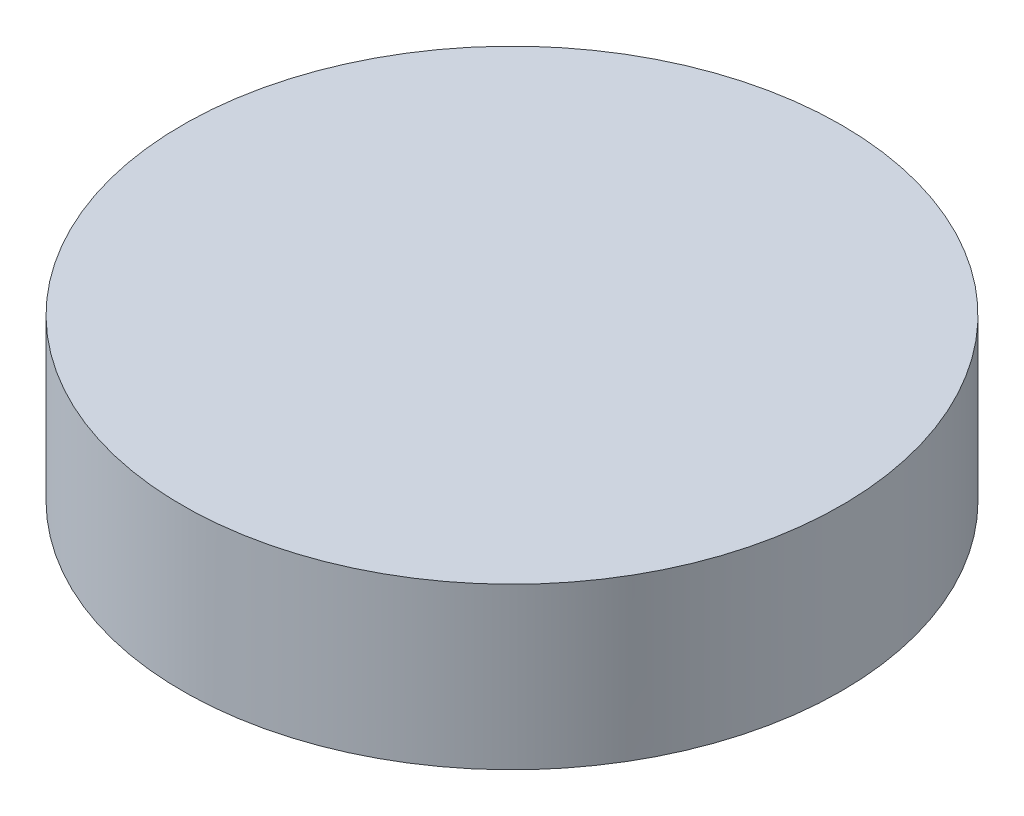
from build123d import *


with BuildPart() as part:
    # 草图4 → 旋转1 (revolve)
    with BuildSketch(Plane.XY, mode=Mode.PRIVATE) as revolve_1_sk:
        with BuildLine():
            Line((0, 20), (0, 21.831999596))
            Line((0, 21.831999596), (44.768578, 21.831999596))
            Line((44.768578, 21.831999596), (44.768578, 1.2849e-05))
            add(Edge.make_bspline(
                [(0, 20), (0.066670165, 20.000092753), (0.160959333, 20.00022393), (0.310056972, 19.999551278), (0.431999365, 19.998698222), (0.568738933, 19.997290174), (0.778979171, 19.994586825), (1.028103777, 19.989993475), (1.244875505, 19.984586774), (1.352893657, 19.981590218), (1.405855054, 19.980063878), (1.457758948, 19.978511319), (1.503384329, 19.977088099), (1.559475575, 19.975310934), (1.610612554, 19.97360254), (1.664530016, 19.971746278), (1.696388446, 19.970623034), (1.758062662, 19.968409647), (1.814595448, 19.966287241), (1.873631922, 19.963997867), (1.916153911, 19.962305005), (1.96471993, 19.960337259), (2.038092076, 19.957268737), (2.106642331, 19.954291275), (2.167532326, 19.95154177), (2.198544811, 19.950124024), (2.229054767, 19.948702465), (2.276753009, 19.946466866), (2.323911011, 19.944181), (2.370380004, 19.941890467), (2.420871406, 19.939353797), (2.470860029, 19.93680178), (2.517531462, 19.934338404), (2.565225672, 19.93181844), (2.612495696, 19.929239022), (2.65935507, 19.926640485), (2.704683181, 19.924089272), (2.747207281, 19.921664142), (2.789396864, 19.919204403), (2.808872778, 19.918056223), (2.847263962, 19.915794686), (2.885377937, 19.913492609), (2.925542269, 19.911041725), (2.951114279, 19.909459492), (2.976515675, 19.907884684), (3.003953409, 19.906156818), (3.028915953, 19.904585043), (3.058167833, 19.902708981), (3.082714264, 19.901132088), (3.124519588, 19.898406572), (3.163772792, 19.895828952), (3.204923084, 19.893062229), (3.243143946, 19.890489343), (3.274844783, 19.888312014), (3.306316387, 19.886137465), (3.322907305, 19.884979169), (3.36389289, 19.882123239), (3.402594465, 19.879362752), (3.441101141, 19.876594304), (3.478802585, 19.873853333), (3.518270049, 19.870971472), (3.55948142, 19.867892053), (3.594194486, 19.86529849), (3.643751787, 19.861533674), (3.702292322, 19.85702447), (3.749032745, 19.853357601), (3.780466843, 19.850876435), (3.813330159, 19.848251031), (3.842426912, 19.84591963), (3.869579981, 19.843719785), (3.883941066, 19.842546919), (3.912450873, 19.840228557), (3.940852133, 19.837878673), (3.970899329, 19.835384957), (3.990176552, 19.83376901), (4.009385573, 19.832162026), (4.028502928, 19.830543597), (4.047532198, 19.828939348), (4.066493968, 19.827317851), (4.083663534, 19.825853732), (4.114290964, 19.823212752), (4.146495266, 19.820436893), (4.178589231, 19.817618304), (4.201996137, 19.81556949), (4.231897784, 19.812917062), (4.261704412, 19.810258289), (4.286401281, 19.808048092), (4.312515551, 19.805684522), (4.346603741, 19.802602103), (4.378951881, 19.799628881), (4.406246494, 19.797116795), (4.431749486, 19.794749735), (4.458756145, 19.792234753), (4.493427247, 19.788971225), (4.523218859, 19.786164886), (4.554446379, 19.783178156), (4.583835765, 19.780371686), (4.614646381, 19.777391849), (4.643800801, 19.774560495), (4.671194514, 19.771878215), (4.696968282, 19.769355682), (4.72265247, 19.766806698), (4.749635994, 19.764136352), (4.772073426, 19.761887258), (4.794438207, 19.759644051), (4.806303073, 19.758444734), (4.821111419, 19.756954808), (4.838809587, 19.755154538), (4.857930857, 19.753215143), (4.877006016, 19.751264797), (4.893084467, 19.749620871), (4.919242735, 19.746920544), (4.945342847, 19.744234455), (4.969924292, 19.741664979), (4.99145536, 19.739426944), (5.017204535, 19.73671461), (5.042897845, 19.734007386), (5.059951215, 19.732194198), (5.082561665, 19.729797815), (5.105121862, 19.727380838), (5.127634709, 19.724966468), (5.140240146, 19.723603879), (5.156996671, 19.721800523), (5.179260952, 19.719382764), (5.20286094, 19.716817967), (5.23185606, 19.713637267), (5.256619456, 19.710924392), (5.28267804, 19.708033092), (5.308570157, 19.705167604), (5.333041483, 19.702428554), (5.354738693, 19.699999465), (5.366892396, 19.698627777), (5.387074649, 19.696360446), (5.407217007, 19.694073855), (5.427322525, 19.691792399), (5.439340587, 19.690417716), (5.455322302, 19.688598142), (5.481844935, 19.685552448), (5.518823127, 19.681294967), (5.551747942, 19.677465103), (5.575350126, 19.674714161), (5.597505492, 19.672110766), (5.620919041, 19.669369338), (5.652010119, 19.665683169), (5.675238681, 19.662934533), (5.697131393, 19.660316558), (5.709964316, 19.658785418), (5.721490729, 19.657398569), (5.74064118, 19.655105758), (5.76229605, 19.65248894), (5.785181978, 19.649720095), (5.802915059, 19.647560387), (5.819343347, 19.645562729), (5.834479185, 19.643711419), (5.847066619, 19.642173354), (5.858373683, 19.640780501), (5.875914785, 19.638630545), (5.894673077, 19.636310062), (5.914647151, 19.633841586), (5.93701483, 19.631054228), (5.959339776, 19.6282826), (5.981616921, 19.625483839), (6.002561013, 19.622862838), (6.019785431, 19.620684095), (6.036977449, 19.618513565), (6.047994155, 19.617113591), (6.067539519, 19.614641123), (6.083398796, 19.612613876), (6.099229082, 19.610594535), (6.10894487, 19.609346869), (6.121079558, 19.607797164), (6.134398051, 19.606079795), (6.147699826, 19.604376332), (6.160980996, 19.60265619), (6.171828694, 19.601258482), (6.187460074, 19.599226323), (6.204269023, 19.597052347), (6.221052889, 19.594860919), (6.233015405, 19.59330328), (6.252094116, 19.59079884), (6.272336134, 19.588155075), (6.292547611, 19.585482983), (6.313853539, 19.582680755), (6.331585822, 19.580320516), (6.350473019, 19.577812479), (6.36106229, 19.576397423), (6.379853929, 19.573898035), (6.395103493, 19.571849195), (6.410328491, 19.569808496), (6.420841652, 19.568390405), (6.440661079, 19.565729638), (6.456963265, 19.563518135), (6.472080276, 19.561472459), (6.482515158, 19.560050722), (6.502188271, 19.557385455), (6.521834221, 19.554696025), (6.5402923, 19.552173802), (6.55868279, 19.549641459), (6.578197893, 19.546967095), (6.601103548, 19.54379414), (6.623931823, 19.540642), (6.647856508, 19.537308513), (6.675111357, 19.533508228), (6.695504151, 19.530646558), (6.713604246, 19.528106834), (6.73163558, 19.5255599), (6.750771187, 19.522869207), (6.771002373, 19.519993403), (6.788928965, 19.517456142), (6.803478534, 19.515377276), (6.818008126, 19.51330638), (6.828044502, 19.511867147), (6.84586059, 19.509324906), (6.860320633, 19.507241597), (6.875869401, 19.505007118), (6.886951032, 19.503403913), (6.902450999, 19.501173098), (6.916819113, 19.499087755), (6.931168513, 19.497011122), (6.949886503, 19.494286905), (6.970770906, 19.491243439), (6.991624978, 19.488188155), (7.011326697, 19.485308508), (7.025536469, 19.483212362), (7.038638919, 19.481284708), (7.047355509, 19.479993908), (7.065847625, 19.477271327), (7.084318039, 19.474525962), (7.103847565, 19.471628696), (7.117916025, 19.469525259), (7.131973103, 19.467437041), (7.143849882, 19.46565499), (7.154632959, 19.464045399), (7.171850211, 19.461452842), (7.1890539, 19.458878728), (7.20623193, 19.456279103), (7.224432523, 19.453538849), (7.242612788, 19.45077723), (7.26077167, 19.448023083), (7.27462219, 19.445908073), (7.289523933, 19.44364215), (7.304405746, 19.441364964), (7.322436824, 19.438608235), (7.338330578, 19.436165445), (7.354205502, 19.433724396), (7.364767419, 19.432092176), (7.379538587, 19.429819728), (7.394289834, 19.42753167), (7.407974705, 19.425415568), (7.418486117, 19.423778178), (7.433178774, 19.42150091), (7.449948504, 19.418882926), (7.474011408, 19.415128788), (7.491769645, 19.412342472), (7.50742114, 19.409885829), (7.52510341, 19.407095481), (7.544852189, 19.403994244), (7.565615121, 19.400699236), (7.583215403, 19.39791802), (7.609037287, 19.393801966), (7.63380335, 19.389854866), (7.652346204, 19.386886231), (7.661599482, 19.385405673), (7.67801924, 19.382761753), (7.694428618, 19.38013445), (7.712864972, 19.377150223), (7.729217151, 19.374517105), (7.745553269, 19.37186438), (7.761869657, 19.369220786), (7.775102421, 19.367060846), (7.788327518, 19.364916504), (7.800518494, 19.362920738), (7.817758893, 19.36011039), (7.833972237, 19.357449737), (7.849159289, 19.354958496), (7.864307118, 19.352460671), (7.881464561, 19.349645928), (7.899610998, 19.346638771), (7.917716044, 19.343651861), (7.934797279, 19.34081142), (7.958870285, 19.336814788), (7.973893454, 19.334302993), (7.988906965, 19.33179792), (8.004875876, 19.329117195), (8.023831048, 19.325953517), (8.042767642, 19.322759602), (8.058677716, 19.320086887), (8.073578679, 19.317566125), (8.090452054, 19.314716926), (8.102342892, 19.312694998), (8.114227918, 19.310687154), (8.124120759, 19.309000776), (8.134993705, 19.307157121), (8.147828932, 19.304961273), (8.159672814, 19.302950098), (8.169531482, 19.30126078), (8.178396857, 19.299749036), (8.190205658, 19.297719554), (8.202990702, 19.295533512), (8.222624808, 19.292156119), (8.240281473, 19.289125379), (8.258896537, 19.285902335), (8.276494678, 19.282867369), (8.292127331, 19.280150425), (8.308719032, 19.277273256), (8.321383206, 19.275062444), (8.350555334, 19.269994127), (8.376778178, 19.265392353), (8.401034577, 19.261139805), (8.412648333, 19.259091011), (8.431980047, 19.255694639), (8.450328725, 19.252450164), (8.466733136, 19.24955017), (8.477329478, 19.247668269), (8.493688191, 19.244772541), (8.508113611, 19.242201292), (8.521566384, 19.239808114), (8.529243491, 19.238435082), (8.544585143, 19.235703631), (8.559912011, 19.232957116), (8.582872375, 19.228845959), (8.61150408, 19.223695991), (8.649612448, 19.216821456), (8.680054255, 19.211299735), (8.70568033, 19.206648858), (8.718947003, 19.204225236), (8.732207615, 19.201808542), (8.747329904, 19.19903652), (8.764340052, 19.195938398), (8.786988334, 19.191769609), (8.802068499, 19.189007832), (8.818076586, 19.186049574), (8.834062094, 19.183108734), (8.849094669, 19.180323762), (8.86974108, 19.17650629), (8.882865684, 19.174064123), (8.89598472, 19.171628875), (8.910013173, 19.169009759), (8.925910338, 19.166061065), (8.950184661, 19.161511268), (8.96697375, 19.158382304), (8.989329353, 19.154173417), (9.004216281, 19.151385058), (9.020019804, 19.148398548), (9.034875613, 19.145603779), (9.048791733, 19.14296751), (9.066403545, 19.139639709), (9.079367997, 19.137182513), (9.092324088, 19.134714884), (9.101571161, 19.132961493), (9.11265781, 19.130843899), (9.123741871, 19.128740777), (9.134815644, 19.126621149), (9.150487788, 19.123634294), (9.166149106, 19.120630252), (9.186397867, 19.11675327), (9.198350493, 19.114451312), (9.211216863, 19.111979044), (9.222229841, 19.109852099), (9.235076921, 19.107383805), (9.246996796, 19.105075945), (9.256159864, 19.103309113), (9.273545882, 19.099932784), (9.29549288, 19.095688891), (9.314684295, 19.091950481), (9.325639488, 19.08981948), (9.339311927, 19.087145197), (9.354806704, 19.084134083), (9.376653238, 19.079845615), (9.392114504, 19.07682651), (9.407564227, 19.073783437), (9.418460046, 19.071645784), (9.429347757, 19.069498951), (9.441138115, 19.067179467), (9.453822713, 19.064667856), (9.469216458, 19.061633693), (9.487308994, 19.05804598), (9.5044845, 19.054642195), (9.524345462, 19.050687122), (9.542389019, 19.047107454), (9.564913487, 19.042599763), (9.581120212, 19.039371881), (9.60180148, 19.035216739), (9.616179288, 19.032343229), (9.63592652, 19.028361117), (9.650278158, 19.025481891), (9.669990166, 19.021494354), (9.685212343, 19.01842862), (9.706675323, 19.014070817), (9.722763669, 19.010820351), (9.743296989, 19.006634165), (9.757570801, 19.003738852), (9.778066297, 18.999547045), (9.794986091, 18.996101898), (9.816334435, 18.991718412), (9.833223002, 18.988265448), (9.852756687, 18.984239685), (9.866955767, 18.981327286), (9.884684103, 18.977661114), (9.898859854, 18.974744341), (9.913910477, 18.971622636), (9.925412656, 18.969247616), (9.936022975, 18.967042732), (9.945746524, 18.96502851), (9.9563448, 18.962819949), (9.967823933, 18.960438872), (9.985467501, 18.956760786), (10.002218724, 18.953269094), (10.020719719, 18.949396394), (10.04359624, 18.944617624), (10.066454243, 18.939812327), (10.091929617, 18.934460596), (10.10509154, 18.931677068), (10.124380939, 18.927612268), (10.138397074, 18.924638779), (10.160287963, 18.920013264), (10.172534608, 18.917405393), (10.184778988, 18.914807513), (10.197007983, 18.912198216), (10.211857686, 18.90904857), (10.237157517, 18.903638957), (10.254598144, 18.899920126), (10.272897482, 18.895994469), (10.280734423, 18.894319746), (10.293786129, 18.891508275), (10.304227144, 18.889274318), (10.314661451, 18.887023997), (10.324222128, 18.88497124), (10.335515759, 18.882538275), (10.347671536, 18.879906517), (10.36069017, 18.877101082), (10.372833697, 18.87446914), (10.384107141, 18.872030857), (10.400564593, 18.868455117), (10.421345452, 18.863953279), (10.448163266, 18.858107749), (10.467179468, 18.853958285), (10.487907379, 18.84943516), (10.500852498, 18.846594421), (10.512931915, 18.843948466), (10.518966784, 18.842620496), (10.529311573, 18.840355797), (10.540511796, 18.83788907), (10.55515358, 18.834672816), (10.565483702, 18.832393828), (10.57495063, 18.830308343), (10.586128175, 18.827833082), (10.599027573, 18.824995774), (10.611918524, 18.822136181), (10.621368411, 18.820050534), (10.639390761, 18.816045243), (10.656553075, 18.812239338), (10.67199206, 18.808806435), (10.686555648, 18.80555525), (10.705398588, 18.801362934), (10.733635894, 18.795044995), (10.76099177, 18.788923971), (10.783204838, 18.783924098), (10.79601195, 18.781044592), (10.807100423, 18.778539955), (10.819043059, 18.775854882), (10.845457674, 18.769885114), (10.869301724, 18.764495163), (10.898238425, 18.757925805), (10.912691923, 18.754634995), (10.92883895, 18.750964969), (10.940728953, 18.748248462), (10.957709425, 18.744378909), (10.96874014, 18.741850824), (10.989942627, 18.737007016), (11.011971698, 18.731944373), (11.040769472, 18.725330279), (11.065306569, 18.71967625), (11.083911073, 18.71538287), (11.097434542, 18.71225446), (11.108416961, 18.709718593), (11.117705823, 18.707560906), (11.126994378, 18.70541063), (11.132901645, 18.704035368), (11.141341973, 18.702083524), (11.150620819, 18.699922885), (11.165800829, 18.696400199), (11.180972187, 18.692858372), (11.203719753, 18.687561273), (11.221398708, 18.683419757), (11.23739339, 18.679684419), (11.244963699, 18.677906714), (11.255056732, 18.6755473), (11.267666319, 18.672581602), (11.282795439, 18.66903237), (11.295395455, 18.666062769), (11.311351071, 18.662312709), (11.324779787, 18.659137434), (11.341562544, 18.655182536), (11.351625915, 18.652796641), (11.361688984, 18.650418006), (11.367555767, 18.649024609), (11.376776147, 18.646845769), (11.38599189, 18.644656537), (11.399394543, 18.641480764), (11.409442032, 18.639088805), (11.425346732, 18.635309809), (11.43538676, 18.632914729), (11.44709997, 18.63012494), (11.452953051, 18.628724421), (11.462151874, 18.626534994), (11.471346243, 18.624333228), (11.484718557, 18.621144181), (11.497248003, 18.61813801), (11.512281337, 18.614538796), (11.523968151, 18.611732627), (11.538990006, 18.608129239), (11.549834207, 18.605515808), (11.566513692, 18.601505975), (11.577349957, 18.598888158), (11.590687114, 18.595673853), (11.599016986, 18.593656849), (11.608181811, 18.591448686), (11.629824587, 18.586204039), (11.648968301, 18.581571112), (11.668937748, 18.57672104), (11.678913672, 18.574288908), (11.688892184, 18.571870528), (11.715475013, 18.565383439), (11.742050614, 18.558904804), (11.767786226, 18.552597897), (11.777742451, 18.550160172), (11.785205755, 18.548322949), (11.795158703, 18.545886533), (11.805107189, 18.543438746), (11.815883415, 18.540792711), (11.82748384, 18.537933349), (11.839911546, 18.534875901), (11.850678185, 18.532216732), (11.859788037, 18.529972181), (11.871375875, 18.527102461), (11.882965606, 18.524246821), (11.898684132, 18.520345492), (11.911093941, 18.517280147), (11.925150034, 18.513784116), (11.935899276, 18.511122469), (11.950772777, 18.507414752), (11.968950718, 18.502900231), (11.985468935, 18.498776741), (12.001982212, 18.494658187), (12.011885735, 18.492177277), (12.023440526, 18.489291104), (12.03168929, 18.487220495), (12.043239694, 18.484336426), (12.058079737, 18.480601293), (12.072098129, 18.477092816), (12.084460498, 18.473978338), (12.093526731, 18.471703897), (12.102587674, 18.469415381), (12.113297795, 18.466723814), (12.123179171, 18.464225369), (12.132238339, 18.461943997), (12.138000767, 18.46048409), (12.145411254, 18.458618963), (12.154462065, 18.45631965), (12.165985319, 18.453413228), (12.175857742, 18.450908315), (12.192309673, 18.446746878), (12.20710821, 18.442976228), (12.228485261, 18.437555223), (12.24081077, 18.434411691), (12.253957732, 18.431061565), (12.263813, 18.428541412), (12.274492483, 18.42582547), (12.291732335, 18.421408426), (12.307330722, 18.41742642), (12.322923242, 18.413427644), (12.332769831, 18.41090624), (12.340971858, 18.408794517), (12.348355827, 18.406905218), (12.355735841, 18.405003417), (12.372955714, 18.400585181), (12.393446723, 18.395299394), (12.420488814, 18.388323691), (12.445059888, 18.381970203), (12.46634914, 18.376451444), (12.480265835, 18.372841931), (12.490084737, 18.370285754), (12.500724828, 18.367530413), (12.514630744, 18.363903453), (12.530173657, 18.359865968), (12.546527559, 18.355595201), (12.562878097, 18.35132221), (12.580044538, 18.346845425), (12.594752529, 18.342987809), (12.611094134, 18.338710658), (12.620078632, 18.336349202), (12.635597697, 18.332278589), (12.644579001, 18.329914004), (12.659276197, 18.326051283), (12.667438348, 18.323897458), (12.682131601, 18.320031476), (12.691107109, 18.317658151), (12.702531892, 18.314646116), (12.710688431, 18.312483654), (12.720480475, 18.30990591), (12.733528058, 18.30644218), (12.745763873, 18.30321373), (12.757992942, 18.299962601), (12.766963169, 18.297590072), (12.778373265, 18.294550977), (12.789787144, 18.291527887), (12.801194892, 18.28848542), (12.810160515, 18.28610644), (12.83296781, 18.280016603), (12.859034944, 18.273072333), (12.889161035, 18.265002283), (12.905441626, 18.260636519), (12.920906769, 18.256491105), (12.929857183, 18.254082107), (12.94287725, 18.250585743), (12.959960296, 18.245983667), (12.981924025, 18.240070406), (12.999001255, 18.235454945), (13.008759199, 18.232819635), (13.016888163, 18.230615905), (13.027459492, 18.227765409), (13.038837582, 18.224674226), (13.055909086, 18.220059048), (13.073784264, 18.215194972), (13.09247385, 18.210118792), (13.106283027, 18.206353425), (13.131466498, 18.199506059), (13.15826208, 18.192176063), (13.184244678, 18.185070027), (13.198042729, 18.181280698), (13.207785753, 18.178618293), (13.222392803, 18.174600731), (13.237001948, 18.170592325), (13.252418645, 18.166347922), (13.264590202, 18.163000364), (13.275135391, 18.160088001), (13.288116328, 18.156512273), (13.305959507, 18.151578291), (13.332726153, 18.144187207), (13.362725426, 18.135860804), (13.390289936, 18.128203705), (13.412176225, 18.122113867), (13.428385967, 18.117594882), (13.442164532, 18.113755629), (13.451077491, 18.111262038), (13.463233484, 18.107869257), (13.472145526, 18.105373163), (13.484300219, 18.101975832), (13.493211396, 18.0994757), (13.502934791, 18.096756008), (13.511033996, 18.094476752), (13.519947164, 18.091983814), (13.529665696, 18.089246543), (13.545058697, 18.084930226), (13.558016087, 18.081277129), (13.57016592, 18.077860083), (13.575833917, 18.076258007), (13.585554286, 18.073526078), (13.595270043, 18.070776458), (13.604988887, 18.068038807), (13.612275685, 18.065975886), (13.620374074, 18.063690289), (13.635757634, 18.059333548), (13.652762435, 18.054524571), (13.674620501, 18.048320767), (13.694051791, 18.042809483), (13.731286265, 18.03220177), (13.765283376, 18.022511315), (13.802509289, 18.01185667), (13.821123385, 18.006525657), (13.840543704, 18.000947131), (13.853490918, 17.997225556), (13.86805861, 17.993043929), (13.878576293, 17.990010192), (13.890714572, 17.986516809), (13.898804938, 17.984179965), (13.910944036, 17.980684079), (13.926316136, 17.976236981), (13.960306605, 17.966423457), (13.988620233, 17.958199554), (14.014510432, 17.950682632), (14.02179113, 17.948561968), (14.030691704, 17.94597494), (14.036354294, 17.944322576), (14.042828546, 17.942443019), (14.054153957, 17.939134753), (14.068720873, 17.93489689), (14.089755132, 17.92874531), (14.109176764, 17.923077913), (14.123737173, 17.918803982), (14.135875847, 17.915253029), (14.143156956, 17.913113519), (14.152057665, 17.910503795), (14.157720443, 17.908836969), (14.165814241, 17.906468694), (14.177948282, 17.90288835), (14.188470649, 17.899806135), (14.199797459, 17.896466163), (14.207082041, 17.894327333), (14.217599322, 17.891219233), (14.224884281, 17.889078213), (14.236211805, 17.885728748), (14.249972435, 17.881675238), (14.263727062, 17.877601084), (14.27748645, 17.873534773), (14.296101257, 17.868016112), (14.321192826, 17.860576611), (14.34385368, 17.853838711), (14.360043535, 17.849025917), (14.372996501, 17.845171825), (14.389184987, 17.840337168), (14.40618833, 17.835270349), (14.426426488, 17.829214736), (14.445051131, 17.823650114), (14.46043318, 17.819035489), (14.472580601, 17.815397449), (14.486346558, 17.811261302), (14.50335578, 17.806159028), (14.527652026, 17.798841523), (14.54709233, 17.792988308), (14.565723378, 17.787370794), (14.573823215, 17.784920507), (14.585167222, 17.781499043), (14.598939747, 17.777327495), (14.617578208, 17.771694287), (14.63297179, 17.767022307), (14.644318169, 17.763585089), (14.652421486, 17.761120973), (14.665392276, 17.757190161), (14.677547683, 17.753484863), (14.699439585, 17.746836871), (14.724571339, 17.739164807), (14.748084536, 17.731992452), (14.762678702, 17.727526026), (14.771602116, 17.72480316), (14.782143728, 17.721569443), (14.793500357, 17.718095342), (14.802421727, 17.715355023), (14.815404386, 17.711381358), (14.827571435, 17.707636829), (14.839743231, 17.703904338), (14.849478023, 17.70090349), (14.860842103, 17.697417169), (14.873012936, 17.693661043), (14.883564936, 17.690413624), (14.898175934, 17.685904865), (14.913600076, 17.681142247), (14.939585599, 17.673118895), (14.959073212, 17.667080658), (14.977749971, 17.661288832), (14.985874179, 17.658773798), (14.994807818, 17.655993933), (15.003746602, 17.653226157), (15.014306495, 17.649937042), (15.026497067, 17.646153239), (15.043561223, 17.640832238), (15.059818301, 17.635773905), (15.083392287, 17.628412653), (15.117555311, 17.61774817), (15.153335944, 17.606522929), (15.185065022, 17.596568218), (15.214367805, 17.58734078), (15.240417247, 17.579132346), (15.260770581, 17.572709451), (15.277061611, 17.567558209), (15.293354731, 17.56240947), (15.311275574, 17.556729988), (15.321056489, 17.55363708), (15.334093472, 17.549491566), (15.343876232, 17.546394163), (15.363442168, 17.540171141), (15.380570102, 17.534738596), (15.400135914, 17.528494639), (15.40747864, 17.526160387), (15.422978166, 17.521208715), (15.440934292, 17.515489677), (15.467047508, 17.507128499), (15.486642959, 17.500864525), (15.502153025, 17.495884664), (15.515223975, 17.491700527), (15.538916939, 17.484081285), (15.562612923, 17.47646431), (15.584678682, 17.469357482), (15.59448792, 17.46618972), (15.605936275, 17.462500917), (15.619020159, 17.458269061), (15.63456466, 17.453254498), (15.650106513, 17.448223252), (15.662381192, 17.444251344), (15.673019024, 17.440799712), (15.682023592, 17.437884852), (15.689389357, 17.435490686), (15.695940333, 17.433370082), (15.704126194, 17.430705489), (15.713137033, 17.427788924), (15.721323605, 17.425118399), (15.731975082, 17.421664738), (15.740164774, 17.418992641), (15.767216527, 17.41019365), (15.790165702, 17.402698323), (15.817216557, 17.393860058), (15.826237643, 17.390905243), (15.837723445, 17.387151062), (15.850029604, 17.383113438), (15.863161955, 17.378816945), (15.885325989, 17.371535294), (15.90503405, 17.365064878), (15.923921971, 17.358854282), (15.932135461, 17.356144352), (15.942821068, 17.352634623), (15.953501805, 17.349104396), (15.969944869, 17.343688343), (15.985565409, 17.338523572), (16.003657726, 17.33254553), (16.016820544, 17.328194669), (16.029983659, 17.32383065), (16.047267217, 17.318095632), (16.066206302, 17.311826609), (16.083494497, 17.306073819), (16.094203246, 17.302517743), (16.104912537, 17.298951608), (16.117275692, 17.294843749), (16.131284176, 17.290168859), (16.142826331, 17.286324993), (16.155193785, 17.282194357), (16.164266845, 17.279171194), (16.173337857, 17.276136574), (16.182416169, 17.273111488), (16.196440905, 17.26840839), (16.211298934, 17.263444446), (16.225331459, 17.25873738), (16.239371376, 17.254034104), (16.25341125, 17.249318086), (16.268283921, 17.2443274), (16.279853376, 17.240439093), (16.293902867, 17.235705957), (16.310444905, 17.230147617), (16.326982162, 17.224565149), (16.341045795, 17.219824357), (16.350974839, 17.216468201), (16.364221232, 17.212002923), (16.377464203, 17.207516296), (16.389057739, 17.203598517), (16.398995668, 17.200229369), (16.417229213, 17.1940618), (16.437945358, 17.187022096), (16.466972483, 17.177178173), (16.486877693, 17.170394372), (16.510945868, 17.16220246), (16.530873259, 17.155396111), (16.549975969, 17.148879503), (16.56493035, 17.143765072), (16.575738306, 17.1400751), (16.590701177, 17.134946209), (16.605672871, 17.129823124), (16.620644067, 17.124682891), (16.634791546, 17.1198322), (16.646442247, 17.115825779), (16.658099354, 17.111824302), (16.668091117, 17.108383069), (16.680588295, 17.104090366), (16.693916836, 17.099490922), (16.708921186, 17.094328036), (16.72392519, 17.089143654), (16.758149131, 17.077339754), (16.796552039, 17.064036601), (16.832454198, 17.051575822), (16.847498243, 17.046346782), (16.855861409, 17.043444095), (16.864223205, 17.040531005), (16.872590099, 17.037625114), (16.881791294, 17.03441335), (16.892673138, 17.030630222), (16.901878545, 17.027416027), (16.911088954, 17.024208736), (16.924488952, 17.019527529), (16.958025855, 17.007817939), (16.991561244, 16.996071779), (17.021755505, 16.985479439), (17.03266896, 16.981644606), (17.043587454, 16.977813188), (17.052826301, 16.974560294), (17.065431386, 16.970128711), (17.078878153, 16.965391821), (17.091489642, 16.960954045), (17.09989741, 16.957986883), (17.106627458, 16.955616523), (17.114196734, 16.952938411), (17.127666352, 16.948196495), (17.140289069, 16.943728473), (17.155445884, 16.938372774), (17.165554269, 16.934798469), (17.176503417, 16.930915021), (17.184089038, 16.928233265), (17.202637984, 16.921649065), (17.220350775, 16.915373273), (17.238061973, 16.909078986), (17.24481565, 16.906683703), (17.254943478, 16.903073052), (17.265923906, 16.899175755), (17.277746004, 16.894960473), (17.287886501, 16.89135488), (17.299716287, 16.887130666), (17.316630343, 16.881105503), (17.335236426, 16.874456391), (17.353003104, 16.868102094), (17.364007486, 16.864168427), (17.373320894, 16.860833105), (17.383487846, 16.857199417), (17.399584521, 16.851419732), (17.417387469, 16.845041355), (17.433496235, 16.839253654), (17.444523875, 16.835292508), (17.453856746, 16.831933699), (17.463195571, 16.828581958), (17.476777704, 16.823682065), (17.487820063, 16.819712284), (17.503962165, 16.813889198), (17.520117634, 16.808069479), (17.543926849, 16.799461425), (17.56435115, 16.79208437), (17.590747388, 16.782514812), (17.61205107, 16.774802046), (17.63421004, 16.76675111), (17.647859863, 16.761795876), (17.661510397, 16.756828508), (17.673462914, 16.75248401), (17.683707434, 16.748748695), (17.700797774, 16.742528947), (17.716179205, 16.736915551), (17.730708015, 16.731608548), (17.74611258, 16.725993961), (17.762366833, 16.720034477), (17.780344444, 16.713466612), (17.803481552, 16.704981251), (17.82748964, 16.69618921), (17.850636498, 16.687678541), (17.860077513, 16.684211301), (17.869519223, 16.680732647), (17.879827, 16.676947863), (17.890991153, 16.672830034), (17.900444774, 16.66935334), (17.908178006, 16.666498207), (17.915056967, 16.663966622), (17.921073897, 16.661742246), (17.930537528, 16.65825771), (17.946024582, 16.652530198), (17.96323977, 16.646171181), (17.978738085, 16.640438331), (17.988216069, 16.636935454), (17.995969101, 16.634057907), (18.002866349, 16.631508407), (18.008899549, 16.629267549), (18.018388234, 16.625757461), (18.028737115, 16.621911178), (18.050320084, 16.613906309), (18.07190765, 16.605874749), (18.100427311, 16.595271455), (18.120318304, 16.587858527), (18.139349372, 16.580750877), (18.160141022, 16.57299677), (18.182668866, 16.56456554), (18.21476255, 16.552559145), (18.240802131, 16.542788903), (18.266858059, 16.533007259), (18.282503416, 16.52712222), (18.295549474, 16.522218697), (18.309472197, 16.516973856), (18.32601624, 16.510746277), (18.350410357, 16.501540375), (18.378317857, 16.491008974), (18.404487387, 16.481103022), (18.432443179, 16.470525364), (18.455170009, 16.461900836), (18.474404039, 16.454594681), (18.486659719, 16.449944859), (18.501545517, 16.444273429), (18.518192274, 16.437950096), (18.540109263, 16.429594148), (18.556778979, 16.423245061), (18.57344782, 16.416878323), (18.584867443, 16.412524191), (18.596285015, 16.408154166), (18.611228129, 16.402446361), (18.635863693, 16.393008004), (18.665799164, 16.38154359), (18.700158897, 16.368345068), (18.723973776, 16.359185817), (18.747812014, 16.350016294), (18.766363846, 16.342858267), (18.782277048, 16.336728836), (18.794656127, 16.331939012), (18.805277854, 16.327844938), (18.815897594, 16.323735617), (18.824753595, 16.320315402), (18.834496725, 16.316541759), (18.845133036, 16.312431732), (18.856654863, 16.307963784), (18.867298901, 16.303845377), (18.878830103, 16.299367354), (18.890370514, 16.294897568), (18.901911058, 16.290412433), (18.91524017, 16.285244112), (18.936577806, 16.276941404), (18.957928551, 16.268643827), (18.980176801, 16.259964301), (18.994430863, 16.254407316), (19.009584054, 16.248500408), (19.022067426, 16.243618863), (19.033667058, 16.239092558), (19.048841594, 16.23315296), (19.069394477, 16.22511788), (19.090840896, 16.216707403), (19.10783468, 16.210049766), (19.118573054, 16.20583044), (19.129320044, 16.201618538), (19.140065764, 16.197388702), (19.151718107, 16.192816177), (19.166061796, 16.187167298), (19.18041612, 16.181524535), (19.192976774, 16.176572426), (19.204651797, 16.171975715), (19.223521705, 16.164524403), (19.240603964, 16.157794012), (19.260390085, 16.149965016), (19.272096681, 16.145344934), (19.284699228, 16.140351383), (19.293712031, 16.136790288), (19.305428198, 16.132140798), (19.323471592, 16.124999382), (19.339713029, 16.118554779), (19.354156061, 16.112815648), (19.364095953, 16.10887241), (19.374939122, 16.10455663), (19.388506548, 16.099169072), (19.406602942, 16.091959525), (19.428336661, 16.08330634), (19.446452974, 16.076074266), (19.465502033, 16.068482098), (19.481835717, 16.061950799), (19.499085325, 16.055056476), (19.511803361, 16.049961069), (19.522713252, 16.045598794), (19.55184674, 16.033917324), (19.581912406, 16.021864101), (19.622939032, 16.005360886), (19.645772131, 15.996174091), (19.675939443, 15.984003589), (19.6933254, 15.976985992), (19.713469974, 15.968852901), (19.721715582, 15.96551381), (19.733634613, 15.960699163), (19.74005273, 15.958096843), (19.749227978, 15.954387082), (19.757486558, 15.951036262), (19.773103207, 15.944720071), (19.789637817, 15.938002241), (19.805266669, 15.93166811), (19.818144105, 15.926430797), (19.83103396, 15.921199335), (19.845767144, 15.915203533), (19.864205773, 15.907706481), (19.879880376, 15.901317407), (19.894643198, 15.895302937), (19.905723061, 15.89077703), (19.919583561, 15.885127491), (19.933448956, 15.879467936), (19.94546876, 15.874547782), (19.95657569, 15.870014948), (19.968608003, 15.865083413), (19.980653421, 15.860164727), (19.992697013, 15.855223071), (20.00382542, 15.850669611), (20.013098837, 15.846863748), (20.022379242, 15.843060361), (20.03723675, 15.836954765), (20.056754402, 15.828948469), (20.073482028, 15.822064448), (20.093033159, 15.814031298), (20.109795517, 15.807119733), (20.131227443, 15.79829164), (20.148952674, 15.790970734), (20.16762648, 15.783268528), (20.19848109, 15.770509188), (20.228436305, 15.758121437), (20.260274572, 15.744908241), (20.277158742, 15.737906997), (20.290296521, 15.732443046), (20.299690325, 15.728545187), (20.315667248, 15.72189419), (20.330716468, 15.715640927), (20.353302286, 15.706226087), (20.371205541, 15.698772023), (20.391939197, 15.69011254), (20.406093973, 15.684207591), (20.420253526, 15.6782852), (20.43348237, 15.67275861), (20.445768425, 15.667614422), (20.456172114, 15.663263327), (20.467525688, 15.658500868), (20.4788892, 15.653747786), (20.491199661, 15.648580063), (20.502576174, 15.643815181), (20.521547331, 15.635842657), (20.543386225, 15.626676716), (20.56713355, 15.616676265), (20.585206735, 15.609075036), (20.604244304, 15.601044472), (20.617581368, 15.595426366), (20.629015551, 15.590596936), (20.635693667, 15.587784404), (20.646185464, 15.583344485), (20.655731508, 15.579317779), (20.671012239, 15.57285232), (20.687265066, 15.56598491), (20.714053559, 15.554632771), (20.735123247, 15.54570989), (20.759082189, 15.53553109), (20.775400099, 15.528607271), (20.792681357, 15.521258173), (20.805175448, 15.515946402), (20.814787938, 15.511849621), (20.823446706, 15.508167775), (20.83210689, 15.504473844), (20.844628365, 15.499145549), (20.856185033, 15.494210179), (20.866787662, 15.489691999), (20.876430874, 15.485570809), (20.88704596, 15.481043694), (20.900559539, 15.475263359), (20.913120371, 15.46990132), (20.927616246, 15.463695349), (20.950852178, 15.453756537), (20.973125465, 15.444210189), (20.994440598, 15.435060173), (21.002202701, 15.431732184), (21.010935565, 15.427975101), (21.02065072, 15.423809113), (21.034250951, 15.417956445), (21.044943923, 15.413362919), (21.056614446, 15.40833527), (21.067324313, 15.403732707), (21.080953067, 15.39785494), (21.093623172, 15.392400599), (21.106296226, 15.386930417), (21.132669209, 15.375559154), (21.161012092, 15.363306981), (21.187406651, 15.35187786), (21.20210108, 15.345520032), (21.212881346, 15.340842927), (21.227594951, 15.334469498), (21.23838719, 15.329781235), (21.251153856, 15.324245506), (21.261961253, 15.319547482), (21.273758285, 15.314425623), (21.289500145, 15.307574365), (21.307228863, 15.299870675), (21.329892974, 15.289993373), (21.348636305, 15.281821837), (21.371357802, 15.271919046), (21.394099091, 15.261977736), (21.41388726, 15.253330785), (21.427751724, 15.247262606), (21.436675073, 15.243362213), (21.446589217, 15.239015545), (21.457507241, 15.234239354), (21.468424632, 15.229447399), (21.484325523, 15.222482846), (21.502223454, 15.214619274), (21.523123001, 15.20544337), (21.541054563, 15.197564162), (21.559001076, 15.189659324), (21.574971442, 15.182635122), (21.588949283, 15.17647113), (21.598944687, 15.172069736), (21.612945693, 15.16588528), (21.626960928, 15.159713053), (21.638969352, 15.154400778), (21.647990985, 15.150422826), (21.6580151, 15.145986138), (21.671055744, 15.140224189), (21.68209383, 15.135335861), (21.692137766, 15.130896321), (21.701177635, 15.126886003), (21.713246126, 15.121547884), (21.727328117, 15.115297425), (21.741421467, 15.109051888), (21.760571167, 15.100549209), (21.786816074, 15.088896163), (21.824207119, 15.072253502), (21.859637082, 15.056471477), (21.891063729, 15.042442363), (21.913402454, 15.032462743), (21.92966246, 15.025187539), (21.944929631, 15.018362133), (21.958165065, 15.012429402), (21.972430678, 15.006043334), (21.982625802, 15.001468482), (21.996916349, 14.995066237), (22.029645442, 14.980365467), (22.066498163, 14.963807139), (22.099271829, 14.949041768), (22.112617519, 14.943028557), (22.122890795, 14.938391067), (22.131115515, 14.934686285), (22.14345755, 14.929109191), (22.153752636, 14.92446836), (22.169197673, 14.917484608), (22.182600852, 14.91143043), (22.199102731, 14.903962212), (22.210456253, 14.898826433), (22.220782959, 14.894145104), (22.226985217, 14.891340352), (22.235253231, 14.88758897), (22.242496271, 14.884312609), (22.253876836, 14.879142698), (22.264233621, 14.874453307), (22.276663738, 14.868804689), (22.28599553, 14.864572368), (22.300517603, 14.857968058), (22.315058592, 14.851367899), (22.330636757, 14.844272465), (22.353536174, 14.833855232), (22.373319262, 14.824836424), (22.393110536, 14.81580492), (22.403549963, 14.811049826), (22.419211405, 14.803885505), (22.43279679, 14.797688248), (22.444295154, 14.792427211), (22.449528276, 14.790039519), (22.458945546, 14.785722426), (22.468374811, 14.78141629), (22.481995097, 14.775174422), (22.495632959, 14.768934729), (22.509271482, 14.762675537), (22.521875472, 14.756899482), (22.533434738, 14.751589977), (22.545005017, 14.746285334), (22.556577858, 14.740962514), (22.566056138, 14.736613142), (22.578699333, 14.730795881), (22.590300603, 14.725466542), (22.60718259, 14.717690775), (22.621971268, 14.710884087), (22.637821466, 14.703573673), (22.652639423, 14.696751311), (22.66640042, 14.690393744), (22.680176876, 14.684039674), (22.69290227, 14.678155418), (22.705639133, 14.672275894), (22.719443765, 14.665886438), (22.734330928, 14.659006328), (22.749219902, 14.652105068), (22.764127919, 14.645205142), (22.777980594, 14.638776739), (22.799327403, 14.62888726), (22.832469193, 14.613484914), (22.867793605, 14.597067912), (22.907481497, 14.578574831), (22.937585929, 14.56453975), (22.966642079, 14.550959882), (22.987134341, 14.541387095), (23.020647944, 14.525693993), (23.063989297, 14.50539814), (23.105180547, 14.486038048), (23.130174215, 14.474290291), (23.147598488, 14.46608462), (23.163950384, 14.458393515), (23.179214746, 14.451191048), (23.186858126, 14.447593761), (23.194500809, 14.443982808), (23.202154303, 14.440380882), (23.215273479, 14.434178069), (23.234989012, 14.424883319), (23.264590903, 14.410875273), (23.293134474, 14.397375038), (23.318416073, 14.385391191), (23.339348868, 14.375470784), (23.35698337, 14.367096184), (23.371325046, 14.360282359), (23.377952825, 14.357138806), (23.386789635, 14.35293146), (23.397852063, 14.347680374), (23.412232885, 14.34083239), (23.429958714, 14.332402034), (23.445475121, 14.325003188), (23.461010024, 14.317606246), (23.472113058, 14.312304026), (23.484341252, 14.306477022), (23.495460228, 14.301162018), (23.505477073, 14.296384579), (23.514383706, 14.292125687), (23.52441561, 14.287338431), (23.536677878, 14.281467683), (23.547835637, 14.276135363), (23.558999546, 14.270789384), (23.572414904, 14.264373036), (23.597038931, 14.252567994), (23.629551862, 14.236974385), (23.667737926, 14.21863802), (23.694725847, 14.205650479), (23.713875757, 14.196433624), (23.728545683, 14.189359649), (23.754549013, 14.176835495), (23.780561706, 14.164267442), (23.802079515, 14.153880158), (23.816826854, 14.146742629), (23.833869127, 14.138509153), (23.850914716, 14.130250434), (23.867987188, 14.121984474), (23.879374655, 14.11646129), (23.8930552, 14.109832828), (23.91132441, 14.100962864), (23.951393397, 14.081514835), (23.988039173, 14.063677011), (24.019008819, 14.048584296), (24.03396936, 14.041296874), (24.052389412, 14.032302493), (24.070834856, 14.023302149), (24.098560844, 14.009745417), (24.125162114, 13.996739753), (24.161082337, 13.979141433), (24.186632815, 13.966618156), (24.211032834, 13.954632318), (24.223841693, 13.948345434), (24.242500292, 13.939166557), (24.26351837, 13.928841233), (24.28453986, 13.918482716), (24.297409377, 13.912146118), (24.307945673, 13.906948318), (24.31849423, 13.901754513), (24.330218532, 13.895963699), (24.3419569, 13.890178517), (24.357225555, 13.882631748), (24.372514925, 13.875087245), (24.38780865, 13.867521967), (24.399589008, 13.861700053), (24.411375814, 13.855860604), (24.424358699, 13.849442112), (24.43970953, 13.841831385), (24.453895724, 13.834806478), (24.474018284, 13.824820227), (24.490608528, 13.816595431), (24.52028688, 13.801847442), (24.540496087, 13.791808222), (24.569055075, 13.777588486), (24.585755756, 13.76927687), (24.604844701, 13.759757069), (24.61679616, 13.753800661), (24.627558003, 13.748426003), (24.644328505, 13.740063688), (24.662304762, 13.731077857), (24.681497868, 13.721484735), (24.698319271, 13.713065875), (24.715162429, 13.704644848), (24.733220556, 13.695591112), (24.750104417, 13.687137152), (24.766998149, 13.678656964), (24.783917908, 13.670171136), (24.798431085, 13.66287884), (24.812962639, 13.655583926), (24.825079751, 13.649486179), (24.839640915, 13.642170471), (24.852995106, 13.635444881), (24.866363366, 13.62871938), (24.894389888, 13.614592728), (24.922439981, 13.600454511), (24.954173824, 13.584423318), (24.971315592, 13.575767779), (24.988463535, 13.56708874), (25.003184797, 13.559643559), (25.016691216, 13.552800444), (25.035138303, 13.543461871), (25.054832832, 13.533472973), (25.078257542, 13.521593988), (25.101720378, 13.509673714), (25.125216614, 13.497736796), (25.145029647, 13.487659536), (25.162389994, 13.478815665), (25.178534514, 13.470598948), (25.193445424, 13.46299387), (25.208381199, 13.455383659), (25.219585954, 13.449661937), (25.232052302, 13.443305537), (25.243279748, 13.437564229), (25.263275234, 13.427361607), (25.288298824, 13.414556581), (25.309586049, 13.403667335), (25.329658453, 13.393383232), (25.343482294, 13.386305109), (25.359821334, 13.377919052), (25.371153399, 13.372112043), (25.383751153, 13.365640016), (25.405215848, 13.354631017), (25.429218688, 13.342281286), (25.454521437, 13.329269383), (25.470993703, 13.320781756), (25.484950838, 13.31359594), (25.497651719, 13.307045475), (25.510367071, 13.300495682), (25.524362424, 13.293270196), (25.539654029, 13.285383554), (25.563902944, 13.272850157), (25.590747494, 13.258981288), (25.615054456, 13.246397121), (25.630434033, 13.238428421), (25.641987017, 13.232447892), (25.654830812, 13.225783018), (25.674135148, 13.215780331), (25.693450722, 13.205755141), (25.711491103, 13.196375273), (25.724405902, 13.189671609), (25.73732495, 13.182946956), (25.750261324, 13.176225467), (25.772290881, 13.164746511), (25.794346517, 13.153266803), (25.817715669, 13.141080032), (25.834640792, 13.132258601), (25.85418337, 13.122046735), (25.873754148, 13.11182811), (25.895974774, 13.100204202), (25.918234021, 13.088567621), (25.939196093, 13.077582177), (25.953634443, 13.07001945), (25.965458925, 13.063816253), (25.979934338, 13.056233364), (25.995733765, 13.047933552), (26.012874185, 13.038941097), (26.026066699, 13.032002459), (26.044577855, 13.022279699), (26.061777222, 13.013223789), (26.080318521, 13.003470889), (26.102893201, 12.991572079), (26.126827398, 12.978967565), (26.153441792, 12.964916238), (26.170785331, 12.955763079), (26.188144965, 12.946584636), (26.205536374, 12.937397416), (26.233691276, 12.922489737), (26.259190901, 12.90898981), (26.282029693, 12.896880755), (26.29280539, 12.891170543), (26.304932077, 12.884728928), (26.32383827, 12.874703926), (26.359035959, 12.855989236), (26.395629591, 12.836529092), (26.439130467, 12.813335956), (26.466401658, 12.798793977), (26.4923306, 12.78494437), (26.507384902, 12.77689357), (26.523831235, 12.768107135), (26.54578802, 12.756352659), (26.571922941, 12.742367137), (26.600848672, 12.726862288), (26.625680833, 12.71352931), (26.64365257, 12.70388583), (26.658879366, 12.695698486), (26.672742245, 12.68825289), (26.693568648, 12.677046536), (26.71581929, 12.665074493), (26.743676891, 12.650072408), (26.764601971, 12.6387818), (26.784165343, 12.628229439), (26.802367571, 12.618396156), (26.821996993, 12.607797589), (26.840240125, 12.597930564), (26.875480637, 12.578879577), (26.909330559, 12.560521647), (26.950316587, 12.538297731), (26.985840038, 12.51899193), (27.022829081, 12.498882734), (27.055615103, 12.481024079), (27.084257824, 12.465422348), (27.110051746, 12.451339365), (27.133013886, 12.438802509), (27.144521158, 12.432509458), (27.154599283, 12.427006956), (27.164683298, 12.42148744), (27.171895454, 12.417549266), (27.181993129, 12.412018133), (27.192107716, 12.406490962), (27.208009368, 12.397774902), (27.231194625, 12.385083325), (27.260216774, 12.369160724), (27.283459781, 12.356406183), (27.302386443, 12.346006866), (27.319903431, 12.336387393), (27.346207297, 12.32191196), (27.371093924, 12.308217246), (27.391617611, 12.296906442), (27.406306249, 12.288811869), (27.419539307, 12.28150841), (27.440174298, 12.270131995), (27.463781709, 12.257087028), (27.487415641, 12.244023621), (27.511125264, 12.230919849), (27.533379551, 12.218588725), (27.557155539, 12.20542525), (27.586981499, 12.188880833), (27.625864874, 12.167310779), (27.664787983, 12.145664365), (27.699364661, 12.126428499), (27.723470106, 12.112990583), (27.750646159, 12.097844665), (27.76880123, 12.087709606), (27.790018362, 12.075867826), (27.808234992, 12.065683915), (27.828000251, 12.054638693), (27.850855613, 12.041847952), (27.881412928, 12.024747558), (27.912005408, 12.007589366), (27.948855917, 11.986920581), (27.979643719, 11.969623804), (28.010472716, 11.952277273), (28.050791004, 11.929590235), (28.091174327, 11.906815202), (28.130053943, 11.884866697), (28.150361397, 11.873386778), (28.167576789, 11.863660187), (28.197390682, 11.846784068), (28.222536358, 11.832552474), (28.2540207, 11.814692724), (28.279310667, 11.800351399), (28.306201043, 11.78507869), (28.326806609, 11.773367416), (28.344283059, 11.763421012), (28.361787568, 11.753468845), (28.382503375, 11.741670494), (28.420929404, 11.719783923), (28.460998349, 11.696910459), (28.501148806, 11.673967573), (28.520498547, 11.662895373), (28.543127637, 11.649951936), (28.569050656, 11.635100045), (28.593378779, 11.621155427), (28.612875556, 11.609965227), (28.625906287, 11.602491984), (28.642209698, 11.593123808), (28.658539435, 11.583748238), (28.678163637, 11.572461527), (28.696184178, 11.56210161), (28.725750055, 11.545074074), (28.758695775, 11.526101972), (28.813275816, 11.494604791), (28.856397646, 11.469685984), (28.89462804, 11.447554613), (28.911322283, 11.437880337), (28.929719776, 11.42722488), (28.959923911, 11.40970307), (28.995237015, 11.389210757), (29.033987991, 11.366674755), (29.064437737, 11.348954985), (29.093272278, 11.332168487), (29.118769175, 11.317304492), (29.158047886, 11.294373362), (29.190543935, 11.275400618), (29.224809692, 11.255350946), (29.245475954, 11.243262031), (29.271328585, 11.228109232), (29.293781832, 11.214952261), (29.312821812, 11.203777345), (29.333645133, 11.191564509), (29.356232523, 11.178288456), (29.389368937, 11.158819964), (29.419062519, 11.141334746), (29.450576512, 11.122776727), (29.469893936, 11.111384254), (29.491007663, 11.098935078), (29.513938032, 11.085391617), (29.540455793, 11.069736343), (29.565239844, 11.055076761), (29.586541791, 11.042479613), (29.604325151, 11.031948506), (29.632870697, 11.01504228), (29.675860541, 10.989545548), (29.727946611, 10.958614111), (29.77118299, 10.932885251), (29.822011898, 10.902620778), (29.865699108, 10.876548279), (29.942698477, 10.830550039), (30.003549182, 10.794095897), (30.070106379, 10.754141061), (30.103621734, 10.733991434), (30.13351408, 10.716011224), (30.159751752, 10.700206354), (30.187938227, 10.683227232), (30.221877873, 10.662749749), (30.27115856, 10.632999301), (30.339765768, 10.591488687), (30.400939465, 10.554403816), (30.443176691, 10.52874302), (30.464417806, 10.5158364), (30.487646712, 10.501704384), (30.512866854, 10.486362759), (30.538137666, 10.470963092), (30.591024488, 10.438741536), (30.642024565, 10.407578044), (30.703062873, 10.370231558), (30.740770871, 10.34712747), (30.778537827, 10.32395552), (30.814511492, 10.301875987), (30.864793707, 10.270953851), (30.917194163, 10.238697856), (30.959645408, 10.212507535), (30.979975178, 10.199965814), (30.998306932, 10.188638429), (31.016678474, 10.177292747), (31.037129935, 10.164640561), (31.061742239, 10.149422929), (31.0843308, 10.13543183), (31.10904878, 10.120122691), (31.137994435, 10.102170332), (31.169059878, 10.082900469), (31.200217419, 10.063538543), (31.225239699, 10.047991224), (31.252401361, 10.031087185), (31.281765344, 10.01281195), (31.315426764, 9.991826202), (31.357679025, 9.965474628), (31.402228027, 9.937640972), (31.453397804, 9.905627497), (31.511345964, 9.869336274), (31.573910354, 9.830058794), (31.625911528, 9.797357942), (31.671722513, 9.768521017), (31.728909479, 9.732464995), (31.786242009, 9.696253852), (31.837188145, 9.664024202), (31.884156921, 9.634273196), (31.931255174, 9.604401796), (31.973980623, 9.577257121), (32.0011436, 9.559993009), (32.032948607, 9.539752803), (32.090122999, 9.503344829), (32.145172665, 9.468206079), (32.247399244, 9.402869031), (32.324530285, 9.353399525), (32.406621289, 9.300619821), (32.43748934, 9.280748906), (32.473222516, 9.257732424), (32.504312645, 9.23767885), (32.537922088, 9.215993229), (32.571663228, 9.194188376), (32.603086989, 9.173873348), (32.637080353, 9.151868877), (32.676133407, 9.12657888), (32.720201591, 9.09798728), (32.764497462, 9.069223364), (32.804069668, 9.043488866), (32.841313648, 9.01925144), (32.871220126, 8.99976154), (32.906304513, 8.976894618), (32.941502565, 8.953914275), (32.979330985, 8.929200049), (33.009740346, 8.909308695), (33.045383182, 8.885985552), (33.096621015, 8.852402666), (33.16105364, 8.810126419), (33.244241632, 8.755411557), (33.314904046, 8.708826591), (33.375489306, 8.668816994), (33.412669468, 8.644228987), (33.46621269, 8.608796472), (33.544579094, 8.556835121), (33.631491513, 8.499066522), (33.708211154, 8.447944793), (33.763576568, 8.410992593), (33.824994746, 8.369954762), (33.912603153, 8.311294432), (34.021078371, 8.238476243), (34.154245763, 8.148767728), (34.25970207, 8.077487009), (34.348562403, 8.017257302), (34.399541308, 7.982656995), (34.44782485, 7.949831712), (34.48731773, 7.922964834), (34.523917263, 7.898028954), (34.573148977, 7.86447234), (34.613253415, 7.837083018), (34.675463262, 7.79456441), (34.719330203, 7.764531469), (34.779118406, 7.723546059), (34.839689198, 7.681963851), (34.90696942, 7.635702774), (34.971488408, 7.591244229), (35.023664579, 7.555252653), (35.082834616, 7.514370265), (35.149119836, 7.468508758), (35.226135871, 7.415110674), (35.33159825, 7.34184893), (35.438081141, 7.267650083), (35.528194908, 7.204670235), (35.59520997, 7.157758562), (35.710546293, 7.076909492), (35.837690815, 6.987420004), (35.947548086, 6.909827305), (36.026485186, 6.853982579), (36.114135024, 6.791866164), (36.206085394, 6.726502088), (36.27998111, 6.673883372), (36.347063555, 6.626034593), (36.451317469, 6.551550113), (36.544255592, 6.484933868), (36.638436301, 6.417277986), (36.700959207, 6.372285207), (36.820005005, 6.286480073), (36.945189279, 6.195941238), (37.080638296, 6.097604907), (37.193080531, 6.015785528), (37.293461632, 5.942522808), (37.381246417, 5.878305366), (37.456709395, 5.823007479), (37.528234009, 5.770507903), (37.615252002, 5.706504135), (37.749877322, 5.607310091), (37.906878305, 5.49113089), (38.056089772, 5.380255922), (38.16248222, 5.300994108), (38.323000039, 5.181155688), (38.474174484, 5.067746447), (38.60495546, 4.969252991), (38.669945613, 4.920254898), (38.741724811, 4.866033167), (38.826709122, 4.801735352), (38.919678582, 4.731243655), (39.164288902, 4.54537627), (39.451126733, 4.325783248), (39.793156559, 4.061745686), (39.992619028, 3.906904253), (40.160641815, 3.775909152), (40.269899355, 3.690528466), (40.373067965, 3.609688341), (40.479921935, 3.525805293), (40.589954304, 3.439206612), (40.732487645, 3.326739821), (40.913388276, 3.183525582), (41.100920722, 3.034388006), (41.300058581, 2.875343746), (41.440007149, 2.763171141), (41.700037501, 2.55409035), (41.985373334, 2.323294287), (42.298320576, 2.06807017), (42.504735959, 1.898957043), (42.678273814, 1.75628299), (43.051462346, 1.448355221), (43.506258805, 1.069435214), (43.967529048, 0.680751807), (44.351315407, 0.355527039), (44.595332262, 0.1476209), (44.768578, 1.2849e-05)],
                knots=[0, 0, 0, 0, 0.003993095, 0.005647288, 0.008930041, 0.011296817, 0.013837514, 0.021523082, 0.026220152, 0.026824717, 0.027995148, 0.029393508, 0.029934809, 0.030729138, 0.032754691, 0.032999285, 0.033960353, 0.034663987, 0.036695544, 0.037348679, 0.038202541, 0.039244349, 0.040259851, 0.042600892, 0.043353927, 0.043910477, 0.044460276, 0.045183256, 0.046770425, 0.047288045, 0.047969822, 0.049798342, 0.050285933, 0.050769025, 0.052658896, 0.053121307, 0.053579906, 0.055378049, 0.055672359, 0.056111075, 0.056546554, 0.057975725, 0.058398011, 0.058956608, 0.059510249, 0.059922309, 0.060603203, 0.061008302, 0.061677904, 0.062076404, 0.063517482, 0.064033975, 0.0645466, 0.065811842, 0.06593712, 0.066436037, 0.066807947, 0.068397839, 0.068759895, 0.069120197, 0.070661868, 0.071130029, 0.071595369, 0.072746747, 0.074106737, 0.075111948, 0.075554793, 0.075995289, 0.077086515, 0.077303083, 0.077626908, 0.077949514, 0.079016269, 0.079333769, 0.079755331, 0.080174898, 0.080488282, 0.080904431, 0.081318669, 0.081628112, 0.081936507, 0.083159858, 0.08356409, 0.083866123, 0.084567138, 0.085362034, 0.085658433, 0.08605223, 0.0869325, 0.087708421, 0.087997837, 0.088574177, 0.089242448, 0.089622357, 0.090659928, 0.091034669, 0.091501215, 0.092428166, 0.092888632, 0.093255589, 0.094076716, 0.094439687, 0.09480146, 0.095700747, 0.095790276, 0.096147684, 0.096414995, 0.096681677, 0.097213158, 0.097566109, 0.097830109, 0.098181172, 0.099141143, 0.099401591, 0.099661461, 0.100437661, 0.100952329, 0.10120884, 0.101464803, 0.102314131, 0.10256778, 0.102820906, 0.103073512, 0.103577181, 0.10416223, 0.104495319, 0.105324216, 0.105654268, 0.106065635, 0.106884451, 0.107129092, 0.107373274, 0.107617, 0.10834548, 0.108587417, 0.108828916, 0.109069977, 0.109550801, 0.110427887, 0.111299358, 0.111536077, 0.111851072, 0.112635449, 0.112947974, 0.113726265, 0.114036393, 0.114268546, 0.114500325, 0.114731729, 0.115423724, 0.115806744, 0.116112441, 0.116493667, 0.116797939, 0.117025734, 0.117253179, 0.117480276, 0.118084193, 0.118385241, 0.118685693, 0.119434231, 0.119732623, 0.120030437, 0.120698429, 0.120772473, 0.121068299, 0.121363564, 0.121952441, 0.122025895, 0.122319377, 0.122539131, 0.122758586, 0.123123671, 0.123342326, 0.123560684, 0.123778748, 0.124286422, 0.124575815, 0.124792524, 0.125008946, 0.125728307, 0.126015184, 0.126230014, 0.127015382, 0.127086598, 0.127371163, 0.127655248, 0.128222005, 0.128292718, 0.12857528, 0.128857377, 0.129490421, 0.129560617, 0.129771039, 0.130121176, 0.130749671, 0.130958676, 0.131236967, 0.131861534, 0.132138427, 0.132621965, 0.13324177, 0.1335852, 0.134270144, 0.134475132, 0.134679897, 0.135360823, 0.135632503, 0.135903793, 0.136445209, 0.136512777, 0.136782814, 0.137052471, 0.137590652, 0.137657818, 0.137993307, 0.138261279, 0.13859573, 0.138862879, 0.139129667, 0.139728626, 0.14012693, 0.140392023, 0.140921167, 0.140987212, 0.141185221, 0.141448927, 0.142106707, 0.14230363, 0.142631419, 0.142958682, 0.143154796, 0.143350722, 0.143611672, 0.144197621, 0.14439258, 0.144652238, 0.145300003, 0.145493949, 0.145752274, 0.146139174, 0.146396725, 0.146653972, 0.147231666, 0.147359834, 0.14761595, 0.147871764, 0.148254938, 0.148510018, 0.148701139, 0.148892095, 0.149400519, 0.149717702, 0.150350739, 0.150477133, 0.1506666, 0.151422896, 0.15167445, 0.151925725, 0.152490118, 0.153240536, 0.153427771, 0.153614856, 0.153801796, 0.154423874, 0.154610187, 0.154920384, 0.155415878, 0.155601429, 0.155910372, 0.156218922, 0.15640387, 0.156650251, 0.157265138, 0.157387931, 0.157572013, 0.158184645, 0.158429285, 0.158673687, 0.159283676, 0.159466387, 0.160135238, 0.160195954, 0.160378029, 0.161105053, 0.161346948, 0.161528226, 0.162071314, 0.162252098, 0.162553137, 0.16279372, 0.16297402, 0.1631542, 0.163454233, 0.163753934, 0.163873725, 0.164053309, 0.164292576, 0.164591363, 0.164830162, 0.165485802, 0.165664347, 0.16596167, 0.166555374, 0.166614676, 0.166970234, 0.167325346, 0.168388069, 0.16856481, 0.168800302, 0.169094397, 0.169740386, 0.169916316, 0.170092148, 0.170384969, 0.170911327, 0.170969753, 0.171203351, 0.171378431, 0.171903067, 0.172135952, 0.172775477, 0.173645438, 0.174455234, 0.174628492, 0.175205344, 0.175262971, 0.175435797, 0.176126161, 0.176298527, 0.176815068, 0.177044385, 0.17727354, 0.177788562, 0.177960058, 0.178531084, 0.178588132, 0.178759225, 0.179385814, 0.179556508, 0.180238415, 0.180408684, 0.180918985, 0.181145549, 0.181371964, 0.181824358, 0.181993857, 0.182445461, 0.182614667, 0.182783791, 0.183009169, 0.183290689, 0.183459498, 0.183684455, 0.184246242, 0.184414608, 0.184919253, 0.184975281, 0.185199316, 0.185591047, 0.18575881, 0.185926496, 0.186149964, 0.186819571, 0.187265327, 0.187321008, 0.187488014, 0.188099734, 0.188266404, 0.188821449, 0.189043251, 0.18920952, 0.189486478, 0.18970791, 0.18992922, 0.190260951, 0.190647633, 0.191033944, 0.191309657, 0.191860531, 0.192135696, 0.192685475, 0.192850272, 0.193399121, 0.19356364, 0.194056809, 0.194275817, 0.194768174, 0.194986824, 0.195587538, 0.19575123, 0.196241933, 0.196459855, 0.197004186, 0.197276111, 0.197765156, 0.198036626, 0.198470638, 0.198633293, 0.199120903, 0.199337458, 0.199553912, 0.199824341, 0.199986523, 0.200148652, 0.200472744, 0.200688682, 0.201228104, 0.201497596, 0.201820786, 0.202627833, 0.202896565, 0.203379898, 0.203433581, 0.204077246, 0.204238056, 0.204773651, 0.204827185, 0.204987738, 0.205522574, 0.20573637, 0.206537284, 0.206590635, 0.206857316, 0.207017263, 0.207390277, 0.207496818, 0.207656578, 0.207975949, 0.20818875, 0.208401496, 0.208773579, 0.208932954, 0.209092314, 0.20978227, 0.210206462, 0.210736239, 0.210948015, 0.211477141, 0.211530015, 0.211688646, 0.211847238, 0.212164274, 0.212375542, 0.212745092, 0.212797858, 0.212956144, 0.213430772, 0.213588915, 0.213746996, 0.214010379, 0.214694671, 0.214799877, 0.214957656, 0.215588405, 0.21595604, 0.216690701, 0.217267356, 0.217319743, 0.217476912, 0.217948214, 0.218052884, 0.219098875, 0.219412349, 0.219830104, 0.219986699, 0.220404115, 0.220560587, 0.22102979, 0.221081911, 0.221863194, 0.222383581, 0.222851616, 0.223371316, 0.223527154, 0.223682973, 0.224046398, 0.224098308, 0.224254009, 0.224409666, 0.224617169, 0.224824619, 0.225343009, 0.225550267, 0.2262235, 0.226430528, 0.22653402, 0.226689245, 0.227051332, 0.227309858, 0.227619981, 0.227826666, 0.228291534, 0.228446451, 0.228859376, 0.228910972, 0.229065772, 0.229220532, 0.229478422, 0.229633094, 0.23004549, 0.230097018, 0.230612201, 0.230663695, 0.230818186, 0.230972658, 0.231230035, 0.231384438, 0.231796032, 0.232001763, 0.232310282, 0.232515891, 0.232926997, 0.232978373, 0.233543345, 0.233594688, 0.233800053, 0.234056667, 0.234159308, 0.23513383, 0.235236349, 0.235390118, 0.235748823, 0.235851298, 0.237028976, 0.237387141, 0.237438303, 0.237642903, 0.237847488, 0.23805202, 0.238256523, 0.238512085, 0.238767604, 0.239023055, 0.239176313, 0.239329542, 0.239738057, 0.239891222, 0.240299543, 0.240503662, 0.240758739, 0.240962795, 0.241421748, 0.241880551, 0.241982487, 0.242441082, 0.242492036, 0.242695806, 0.242950456, 0.243205068, 0.243612347, 0.243815962, 0.243968629, 0.244172181, 0.244375695, 0.244630041, 0.244782636, 0.24493522, 0.244986077, 0.245240317, 0.245494523, 0.245697858, 0.245850346, 0.246510919, 0.246612512, 0.247171218, 0.247272767, 0.247425092, 0.247780477, 0.247932758, 0.248490998, 0.248744679, 0.248896869, 0.249099772, 0.249251947, 0.249353367, 0.249556227, 0.250316712, 0.250620819, 0.25122889, 0.25183676, 0.251938051, 0.252089988, 0.252444449, 0.252596343, 0.252950724, 0.253406262, 0.253608683, 0.253962902, 0.254468807, 0.25451939, 0.254974626, 0.255025196, 0.255480323, 0.255530878, 0.255935356, 0.255985916, 0.256440859, 0.256491405, 0.256693567, 0.256946259, 0.257097865, 0.257502098, 0.257704185, 0.257855748, 0.25805783, 0.2584114, 0.258562936, 0.258764961, 0.258966964, 0.2599768, 0.260380662, 0.260834935, 0.260986351, 0.261339621, 0.261390084, 0.261793795, 0.26239926, 0.262752408, 0.262853307, 0.263004635, 0.263256854, 0.263509073, 0.26371081, 0.26431603, 0.264618608, 0.264870747, 0.265173304, 0.266181693, 0.26653459, 0.266786641, 0.267038703, 0.267139528, 0.267693995, 0.267946033, 0.268097241, 0.26845006, 0.268601265, 0.268903671, 0.269558855, 0.270264407, 0.270768354, 0.271272302, 0.271625051, 0.271776233, 0.272128985, 0.272179376, 0.272532123, 0.272683299, 0.272935265, 0.273086452, 0.273288018, 0.273439196, 0.273640779, 0.273892741, 0.274396696, 0.274447095, 0.274648668, 0.274749472, 0.275051837, 0.275253433, 0.275354219, 0.275505421, 0.27575742, 0.276311831, 0.276563841, 0.277118283, 0.277521543, 0.278882675, 0.279235589, 0.279840657, 0.280042359, 0.280445775, 0.28064751, 0.280950102, 0.281101397, 0.281404022, 0.28145447, 0.281857998, 0.282362463, 0.283573426, 0.283623883, 0.283977151, 0.284027613, 0.28417903, 0.284330447, 0.284431389, 0.284885695, 0.285239081, 0.285743973, 0.286097437, 0.286147947, 0.286501469, 0.286551965, 0.286703483, 0.28685502, 0.287057056, 0.287461208, 0.287511721, 0.287764337, 0.287915924, 0.288168568, 0.288219111, 0.288623407, 0.289027753, 0.289078302, 0.289482738, 0.290190622, 0.290645787, 0.290898699, 0.291202226, 0.291455198, 0.291910599, 0.292264868, 0.292720429, 0.293074817, 0.293226717, 0.293479908, 0.29393572, 0.294290305, 0.29499966, 0.295151698, 0.295455801, 0.295506499, 0.29586136, 0.296317693, 0.296672692, 0.296824862, 0.297027764, 0.297179971, 0.297636617, 0.297788866, 0.298550276, 0.299210419, 0.299261213, 0.299464389, 0.299769201, 0.299921625, 0.300175691, 0.300328171, 0.300734808, 0.300938147, 0.301090687, 0.301344931, 0.30165009, 0.301853565, 0.302006179, 0.302565912, 0.302820407, 0.303635039, 0.303787837, 0.303991575, 0.304144409, 0.304348209, 0.304552026, 0.304806846, 0.305112706, 0.305622592, 0.305826582, 0.306591869, 0.307766111, 0.308072593, 0.308583567, 0.309606115, 0.30970841, 0.309861855, 0.310629457, 0.310731826, 0.310987809, 0.31124386, 0.311551181, 0.311602399, 0.312473576, 0.312627395, 0.312832489, 0.312935044, 0.313601937, 0.313961173, 0.314577271, 0.314834082, 0.314936832, 0.315399267, 0.316324706, 0.316427587, 0.316787716, 0.31694209, 0.317147983, 0.317611325, 0.317920349, 0.318126398, 0.318384028, 0.318590184, 0.318693265, 0.318847909, 0.31900259, 0.319208865, 0.319415165, 0.31951834, 0.319879515, 0.319931122, 0.321222116, 0.321325473, 0.321635575, 0.321790664, 0.322049211, 0.322411291, 0.322618231, 0.323446497, 0.323653663, 0.32380908, 0.323964515, 0.324327299, 0.324482822, 0.325001394, 0.32531268, 0.325624054, 0.325831712, 0.326143262, 0.326714726, 0.327026566, 0.327234533, 0.327390548, 0.327702609, 0.328014809, 0.328275051, 0.328431236, 0.328795761, 0.32884784, 0.329004126, 0.329368885, 0.329733801, 0.329942375, 0.330255365, 0.330620629, 0.330829443, 0.331194954, 0.331351651, 0.331717383, 0.332240148, 0.332397035, 0.332606273, 0.332867886, 0.333234271, 0.333443724, 0.333600839, 0.333862763, 0.334596577, 0.334911282, 0.335698549, 0.335856102, 0.336434018, 0.336959768, 0.33706497, 0.33738062, 0.337643781, 0.338012333, 0.338328371, 0.338591836, 0.338908096, 0.339066277, 0.339330009, 0.339541035, 0.339857702, 0.340174495, 0.34049141, 0.340808477, 0.342342779, 0.342925587, 0.343084613, 0.343296695, 0.343455798, 0.343614952, 0.34382718, 0.344039498, 0.344304966, 0.344411166, 0.34462363, 0.345155102, 0.346538722, 0.346751823, 0.34707159, 0.347231546, 0.347444864, 0.347658232, 0.348031806, 0.348298747, 0.348458978, 0.348565815, 0.348726103, 0.348939867, 0.349421088, 0.349528085, 0.349902667, 0.350063248, 0.350223893, 0.350384552, 0.351242122, 0.351349394, 0.351510333, 0.35167131, 0.351993379, 0.352208184, 0.35242304, 0.352637978, 0.352960527, 0.353498436, 0.353821381, 0.354090645, 0.35419837, 0.354413884, 0.354737301, 0.355222719, 0.355546533, 0.355762494, 0.355924519, 0.356140608, 0.356356762, 0.356789317, 0.356843413, 0.357384551, 0.357817791, 0.358359767, 0.35868518, 0.35949944, 0.359716764, 0.36009724, 0.360369178, 0.360586791, 0.360858941, 0.361022272, 0.361676069, 0.361839619, 0.361948687, 0.362658074, 0.362876512, 0.363095034, 0.364134088, 0.364407827, 0.364572119, 0.364736469, 0.365010484, 0.365229788, 0.365449163, 0.365613769, 0.365723517, 0.365888182, 0.365997981, 0.366327528, 0.366877155, 0.367097152, 0.367317245, 0.367482352, 0.367592459, 0.367757663, 0.367867821, 0.368198408, 0.368418918, 0.369246545, 0.369577946, 0.370241294, 0.370517927, 0.370794682, 0.37157036, 0.371958597, 0.37284699, 0.373236126, 0.37362552, 0.373848144, 0.37407087, 0.374516606, 0.3749069, 0.375632495, 0.376303137, 0.376582816, 0.377422711, 0.377759041, 0.377815119, 0.3782078, 0.378713119, 0.378881658, 0.379612651, 0.379781492, 0.379950359, 0.380344641, 0.380513707, 0.380908421, 0.381924731, 0.38243363, 0.383112948, 0.383452941, 0.383963367, 0.384303921, 0.384474295, 0.384758359, 0.384985714, 0.385156306, 0.385326957, 0.385611504, 0.385839258, 0.386067108, 0.386295068, 0.38658015, 0.386808336, 0.387036636, 0.387436389, 0.38817966, 0.38840858, 0.388866725, 0.389095967, 0.389382674, 0.389669529, 0.389841728, 0.390358671, 0.39099124, 0.391221469, 0.391451809, 0.391682264, 0.391912811, 0.392143473, 0.392431973, 0.392836125, 0.393067245, 0.393240631, 0.393587628, 0.394282352, 0.394340294, 0.394862083, 0.395036128, 0.395152197, 0.3954425, 0.395791085, 0.396314445, 0.396489037, 0.39672192, 0.396954914, 0.397188023, 0.397596243, 0.398121617, 0.398589109, 0.398764554, 0.399349809, 0.399642701, 0.399877155, 0.400170396, 0.40034643, 0.4017571, 0.402110448, 0.402995007, 0.403231193, 0.404058769, 0.404117938, 0.404532344, 0.404591584, 0.404887852, 0.404947144, 0.40518434, 0.405421651, 0.405956084, 0.406253269, 0.406431672, 0.406788706, 0.407086448, 0.407384366, 0.407980854, 0.408100247, 0.408339125, 0.408697694, 0.408996711, 0.409236088, 0.409475579, 0.409715209, 0.410014925, 0.410254851, 0.410494901, 0.41073508, 0.410855224, 0.411095604, 0.411697156, 0.412118733, 0.412179002, 0.412963131, 0.413204683, 0.413567267, 0.414111742, 0.414414523, 0.415567034, 0.416053223, 0.416479121, 0.416661778, 0.416905429, 0.41708826, 0.417698294, 0.417881494, 0.418553825, 0.418859809, 0.419227259, 0.419472416, 0.419779066, 0.420085943, 0.420270168, 0.420454479, 0.420823349, 0.421007906, 0.421254124, 0.421562079, 0.42224041, 0.422672665, 0.42310536, 0.423414717, 0.423910184, 0.423972141, 0.424158129, 0.424344185, 0.424654481, 0.424778659, 0.425337952, 0.425711249, 0.426521233, 0.426708385, 0.427270365, 0.427582907, 0.427833124, 0.428083499, 0.42820874, 0.428396665, 0.428647401, 0.42902377, 0.42914931, 0.429337683, 0.429651868, 0.429840488, 0.430217992, 0.43046986, 0.430784915, 0.431731636, 0.43192125, 0.432174208, 0.432237464, 0.432490642, 0.432807323, 0.433124251, 0.433187674, 0.433568414, 0.433822426, 0.434076625, 0.434394599, 0.434649149, 0.435796766, 0.436243972, 0.436371851, 0.436755712, 0.436947789, 0.437332222, 0.437460453, 0.437781216, 0.438038028, 0.438230737, 0.438809476, 0.439195777, 0.439711478, 0.440034127, 0.440680278, 0.441197989, 0.441327522, 0.441586722, 0.441781264, 0.441975877, 0.442300472, 0.442495359, 0.443015582, 0.443471342, 0.443862437, 0.444188672, 0.44464587, 0.444907387, 0.44510364, 0.445299999, 0.44582412, 0.446020857, 0.446086458, 0.446414652, 0.446677413, 0.446940351, 0.44713769, 0.447335124, 0.447532666, 0.447928066, 0.448257893, 0.448455937, 0.449182982, 0.449977772, 0.450907231, 0.451506009, 0.452039054, 0.452372616, 0.452572913, 0.453040677, 0.453241327, 0.453509033, 0.453709957, 0.454179206, 0.455657953, 0.456129757, 0.456332148, 0.456534663, 0.456804845, 0.456872423, 0.457345837, 0.457481206, 0.457887651, 0.458226694, 0.458566065, 0.458633988, 0.458905781, 0.458973757, 0.459177776, 0.459381909, 0.459722413, 0.459858702, 0.460199657, 0.460336123, 0.4608142, 0.461156083, 0.461361376, 0.462320971, 0.462458279, 0.462664334, 0.463008031, 0.463489782, 0.46355867, 0.463765372, 0.463834295, 0.464179145, 0.464386227, 0.464731644, 0.465077397, 0.465285001, 0.465562034, 0.465839262, 0.466047345, 0.466324972, 0.466463864, 0.466880899, 0.467089619, 0.467577083, 0.467855959, 0.468135049, 0.468554129, 0.468763861, 0.469043703, 0.469393835, 0.469604071, 0.469954778, 0.470376093, 0.47058696, 0.470938669, 0.47129076, 0.471996032, 0.473127534, 0.473623786, 0.474618464, 0.475116916, 0.475544744, 0.475973129, 0.477333325, 0.478411127, 0.478699124, 0.478987396, 0.47956466, 0.479781419, 0.479998294, 0.480070615, 0.480287686, 0.480504916, 0.480939767, 0.481593163, 0.482466365, 0.482830912, 0.483268865, 0.48385377, 0.484000154, 0.484219854, 0.484293117, 0.484586348, 0.484953277, 0.485247103, 0.485761963, 0.485982855, 0.486277632, 0.486498897, 0.486794146, 0.487015758, 0.487163582, 0.487385444, 0.487681511, 0.487977844, 0.488126113, 0.488422865, 0.488868509, 0.489761655, 0.490582563, 0.491405614, 0.491555485, 0.491855449, 0.492381064, 0.493284143, 0.493585753, 0.493812144, 0.494265423, 0.494719353, 0.49494658, 0.495401498, 0.495477378, 0.495857066, 0.496617852, 0.498144989, 0.498298119, 0.498681273, 0.499141678, 0.499525857, 0.499910535, 0.50099016, 0.501299325, 0.502306245, 0.502694398, 0.502927524, 0.503160837, 0.503939829, 0.504330069, 0.504564443, 0.504798996, 0.505033736, 0.505268663, 0.505582188, 0.505817534, 0.506288762, 0.506603339, 0.50683947, 0.507075788, 0.507391177, 0.507706896, 0.508101998, 0.508339306, 0.509052357, 0.509211051, 0.510324218, 0.510403877, 0.511121845, 0.511441509, 0.511681468, 0.511921633, 0.512161985, 0.512803856, 0.513125313, 0.513447119, 0.513930484, 0.514253165, 0.514657005, 0.515061399, 0.515385312, 0.515790697, 0.516034201, 0.516359168, 0.516603146, 0.517010202, 0.517254706, 0.517499434, 0.518889985, 0.519136063, 0.519628843, 0.520040124, 0.520287167, 0.520616896, 0.520946974, 0.521525533, 0.521939514, 0.522520049, 0.523101764, 0.523517979, 0.523851392, 0.52426868, 0.52460296, 0.524853909, 0.525272664, 0.525356486, 0.525692018, 0.526027934, 0.526700974, 0.527375598, 0.527460028, 0.528051786, 0.528305776, 0.528559999, 0.528814427, 0.529154047, 0.530004823, 0.530431164, 0.530858158, 0.531114672, 0.531371391, 0.531714071, 0.531971336, 0.532314741, 0.532744572, 0.533606214, 0.53412445, 0.534383935, 0.534643653, 0.534903613, 0.535250599, 0.535945851, 0.536207029, 0.536468421, 0.53681736, 0.537079343, 0.537341568, 0.538305163, 0.538568553, 0.538920115, 0.539448292, 0.539889192, 0.540242439, 0.540950258, 0.54139356, 0.541659888, 0.541926467, 0.542193306, 0.542638624, 0.542995374, 0.543352609, 0.543531392, 0.544247698, 0.544516805, 0.544786154, 0.545776094, 0.546136941, 0.546588703, 0.546950644, 0.547313051, 0.547766742, 0.548858734, 0.549041139, 0.549315007, 0.549589145, 0.549863559, 0.550596705, 0.55197672, 0.552345917, 0.553549304, 0.553827792, 0.554106541, 0.554571795, 0.554944581, 0.555598198, 0.556347136, 0.556910234, 0.557286305, 0.557568698, 0.557945694, 0.558228778, 0.558985176, 0.559459021, 0.560123824, 0.560409251, 0.560790324, 0.56136293, 0.56174535, 0.562032546, 0.563762283, 0.564051698, 0.564824991, 0.566183807, 0.566573325, 0.567061074, 0.568137306, 0.568333475, 0.568627986, 0.568922846, 0.569021197, 0.569316506, 0.56941501, 0.569710769, 0.570006853, 0.570501101, 0.571293851, 0.57198951, 0.572089029, 0.572587278, 0.573186449, 0.57388726, 0.574288599, 0.574589996, 0.574891754, 0.575193871, 0.576001279, 0.576507191, 0.576811232, 0.577623777, 0.578031016, 0.57843894, 0.579666578, 0.58069421, 0.581106435, 0.582036395, 0.582347149, 0.58296982, 0.583281726, 0.583802442, 0.584219797, 0.584637836, 0.585371113, 0.58631707, 0.586738639, 0.587901679, 0.588432137, 0.588857317, 0.590672529, 0.591208967, 0.591531384, 0.592069705, 0.592393247, 0.593583266, 0.593800245, 0.59456122, 0.595324565, 0.595652442, 0.595980761, 0.596528941, 0.596858448, 0.597408621, 0.599177546, 0.599621812, 0.600178286, 0.600512788, 0.601183191, 0.601967668, 0.602192273, 0.602529588, 0.602867365, 0.603318467, 0.60365737, 0.604223259, 0.604563426, 0.605700849, 0.606500281, 0.608337688, 0.608683782, 0.609146026, 0.60949332, 0.609957143, 0.611237417, 0.611938667, 0.612642019, 0.613347483, 0.613937006, 0.614409667, 0.616071584, 0.616190749, 0.616787467, 0.617505573, 0.61798552, 0.61834614, 0.618827848, 0.619431378, 0.619915352, 0.621129692, 0.621495262, 0.622105792, 0.622472897, 0.622963288, 0.623700833, 0.624317264, 0.62468792, 0.625183073, 0.625555121, 0.626674964, 0.628176672, 0.629183354, 0.629688359, 0.63171977, 0.63223048, 0.635060349, 0.635968283, 0.636879943, 0.637402547, 0.63805756, 0.638714491, 0.639373367, 0.640431658, 0.642162228, 0.644176087, 0.64471624, 0.645122236, 0.645664732, 0.646344742, 0.646890281, 0.647437177, 0.650053903, 0.650469968, 0.651722984, 0.652702583, 0.653123783, 0.654251033, 0.656238061, 0.65680918, 0.657238534, 0.657668742, 0.658099828, 0.658531785, 0.659109101, 0.659832956, 0.660123186, 0.660850495, 0.661872974, 0.66231269, 0.663047594, 0.663637375, 0.664228814, 0.665119099, 0.666013185, 0.667211278, 0.668265258, 0.669628292, 0.671306448, 0.672689685, 0.673307459, 0.674548567, 0.676738758, 0.677368864, 0.678159231, 0.68006874, 0.680709256, 0.681190985, 0.681996413, 0.682967186, 0.685250705, 0.685907961, 0.69023362, 0.690738858, 0.691753213, 0.692432362, 0.693284588, 0.693969061, 0.694827995, 0.695690722, 0.696210191, 0.697253306, 0.69847736, 0.69935644, 0.700416613, 0.701304573, 0.70201787, 0.70255461, 0.703812821, 0.704535532, 0.70526096, 0.705989183, 0.707086725, 0.708930197, 0.710604804, 0.713050245, 0.713999366, 0.714953307, 0.715719998, 0.717844851, 0.720584969, 0.721970466, 0.723366536, 0.724571728, 0.726394599, 0.729681322, 0.732396789, 0.736011395, 0.737304972, 0.73882628, 0.739701545, 0.740801846, 0.741687103, 0.742354035, 0.744370313, 0.744595816, 0.746867115, 0.747554416, 0.748937339, 0.751267509, 0.752444712, 0.753630196, 0.755063896, 0.756752237, 0.758457847, 0.760676912, 0.764443261, 0.766231096, 0.767261635, 0.769342721, 0.774667153, 0.776573871, 0.777398163, 0.780458479, 0.783008148, 0.784155069, 0.785891743, 0.787943294, 0.791829101, 0.792740369, 0.794888692, 0.796442631, 0.801529497, 0.804141858, 0.806467664, 0.809858273, 0.811584995, 0.812982034, 0.815461597, 0.816898989, 0.819451804, 0.825477137, 0.828596905, 0.83058575, 0.833423302, 0.840594622, 0.841904701, 0.843229125, 0.845469423, 0.84729253, 0.849611793, 0.852457319, 0.865692672, 0.871247826, 0.878336549, 0.880816327, 0.884008271, 0.886641474, 0.888666453, 0.892144554, 0.895027932, 0.899540785, 0.905963632, 0.909378671, 0.914804909, 0.916705825, 0.929362852, 0.936785268, 0.940892316, 0.945345144, 0.950240809, 0.969870402, 0.980799595, 0.986368203, 1, 1, 1, 1], degree=3))
        make_face()
    revolve(revolve_1_sk.sketch.rotate(Axis((0, 0, 0), (0, 1, 0)), 90), axis=Axis((0, 0, 0), (0, 1, 0)))


solid = part.part
